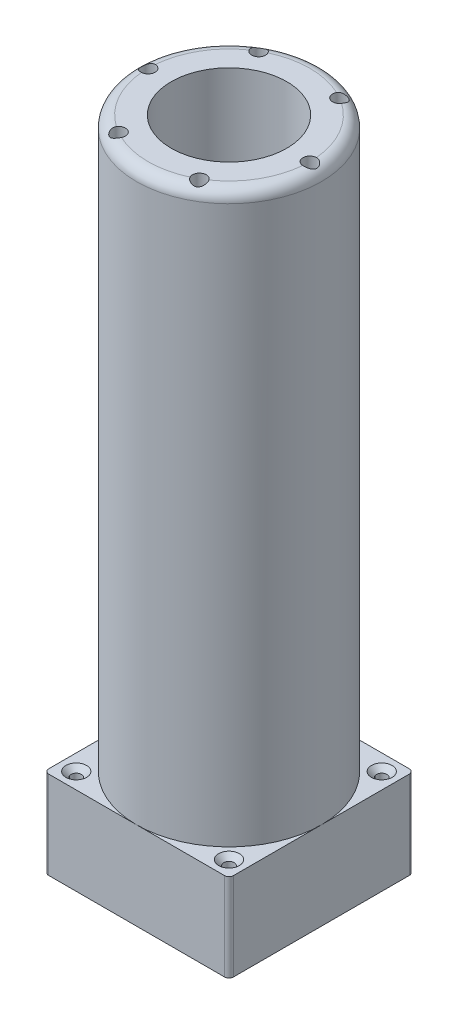
from build123d import *

# Parameters (mm, degrees)
DODANIE_WYCI_GNI_CIE1_DEPTH                        = 38
SZKIC2_R                                           = 40
DODANIE_WYCI_GNI_CIE2_DEPTH                        = 246
POG_BIENIE_STO_KOWE_POD_M4_WKR_T_Z_BEM_D           = 4.5
POG_BIENIE_STO_KOWE_POD_M4_WKR_T_Z_BEM_CSINK_D     = 8.96
POG_BIENIE_STO_KOWE_POD_M4_WKR_T_Z_BEM_CSINK_ANGLE = 90
SZKIC6_R                                           = 25
WYTNIJ_WYCI_GNI_CIE1_DEPTH                         = 290.579004764
ZAOKR_GLENIE1_R                                    = 5
OTWORY_USTALAJ_CE_6_0MM1_D                         = 6
OTWORY_USTALAJ_CE_6_0MM1_DEPTH                     = 35
OTWORY_USTALAJ_CE_6_0MM1_TIP                       = 1.802581857


with BuildPart() as part:
    # Szkic1 → Dodanie-wyciągnięcie1 (new body)
    with BuildSketch(Plane(origin=(0, 0, 0), x_dir=(1, 0, 0), z_dir=(0, 1, 0))):
        with BuildLine():
            Line((-38, -40), (38, -40))
            ThreePointArc((38, -40), (39.414213562, -39.414213562), (40, -38))
            Line((40, -38), (40, 38))
            ThreePointArc((40, 38), (39.414213562, 39.414213562), (38, 40))
            Line((38, 40), (-38, 40))
            ThreePointArc((-38, 40), (-39.414213562, 39.414213562), (-40, 38))
            Line((-40, 38), (-40, -38))
            ThreePointArc((-40, -38), (-39.414213562, -39.414213562), (-38, -40))
        make_face()
    extrude(amount=DODANIE_WYCI_GNI_CIE1_DEPTH)

    # Szkic2 → Dodanie-wyciągnięcie2 (add)
    with BuildSketch(Plane(origin=(0, 38, 0), x_dir=(1, 0, 0), z_dir=(0, 1, 0))):
        with Locations(Location((0, 0, 0), (0, 0, 270))):
            Circle(SZKIC2_R)
    extrude(amount=DODANIE_WYCI_GNI_CIE2_DEPTH)

    # Pogłębienie stożkowe pod M4 Wkręt z łbem stożkowym płaskim1 (through all)
    with Locations(Plane(origin=(0, 38, 0), x_dir=(1, 0, 0), z_dir=(0, 1, 0))):
        with Locations((-33.050252532, 33.050252532), (33.050252532, 33.050252532), (33.050252532, -33.050252532), (-33.050252532, -33.050252532)):
            CounterSinkHole(POG_BIENIE_STO_KOWE_POD_M4_WKR_T_Z_BEM_D / 2, POG_BIENIE_STO_KOWE_POD_M4_WKR_T_Z_BEM_CSINK_D / 2, counter_sink_angle=POG_BIENIE_STO_KOWE_POD_M4_WKR_T_Z_BEM_CSINK_ANGLE)

    # Szkic6 → Wytnij-wyciągnięcie1 (cut, through all)
    with BuildSketch(Plane(origin=(0, 284, 0), x_dir=(1, 0, 0), z_dir=(0, 1, 0))):
        with Locations(Location((0, 0, 0), (0, 0, 270))):
            Circle(SZKIC6_R)
    extrude(amount=-WYTNIJ_WYCI_GNI_CIE1_DEPTH, mode=Mode.SUBTRACT)

    # Zaokrąglenie1
    zaokr_glenie1_edges = [part.edges().sort_by_distance(p)[0] for p in [
        (0, 284, -40),
    ]]
    fillet(zaokr_glenie1_edges, radius=ZAOKR_GLENIE1_R)

    # Otwory ustalające Ø6.0mm1
    with Locations(Plane(origin=(0, 284, 0), x_dir=(1, 0, 0), z_dir=(0, 1, 0))):
        with Locations((-17.5, 30.310889132), (17.5, 30.310889132), (35, 0), (17.5, -30.310889132), (-17.5, -30.310889132), (-35, 0)):
            Hole(OTWORY_USTALAJ_CE_6_0MM1_D / 2, depth=OTWORY_USTALAJ_CE_6_0MM1_DEPTH)
            with Locations((0, 0, -(OTWORY_USTALAJ_CE_6_0MM1_DEPTH + OTWORY_USTALAJ_CE_6_0MM1_TIP / 2))):  # 118° drill point
                Cone(0, OTWORY_USTALAJ_CE_6_0MM1_D / 2, OTWORY_USTALAJ_CE_6_0MM1_TIP, mode=Mode.SUBTRACT)


solid = part.part
